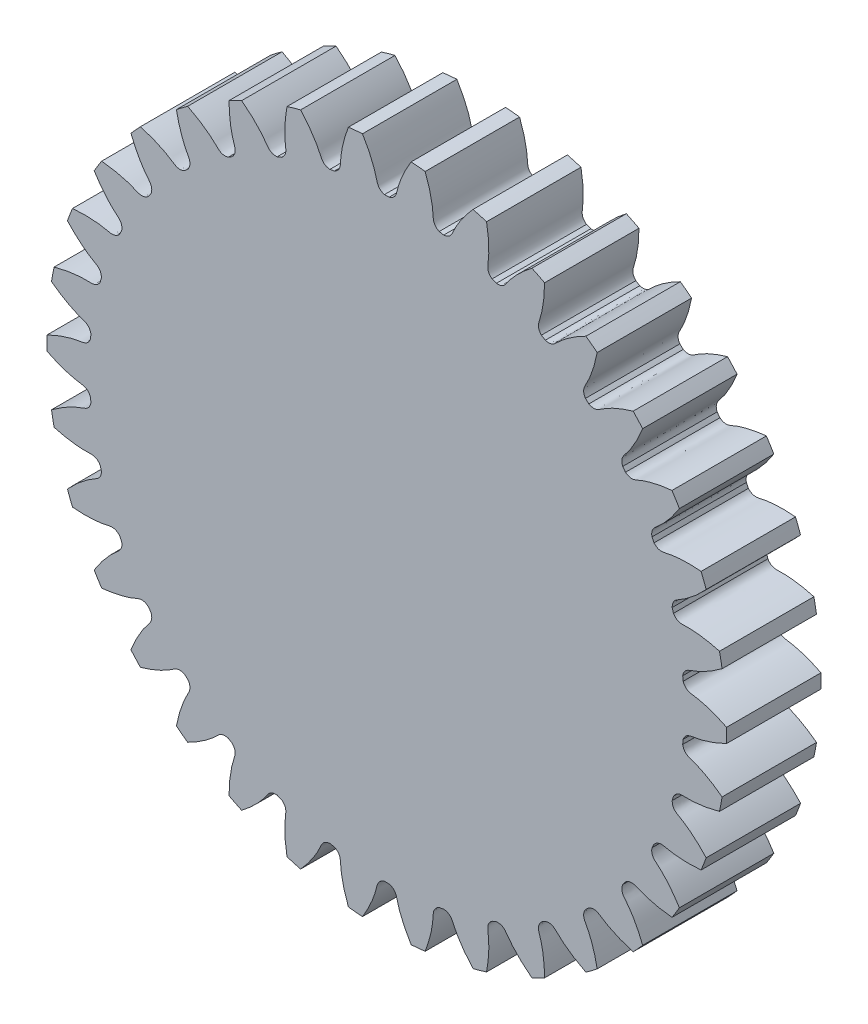
from build123d import *

# Parameters (mm, degrees)
SKETCH_1_R               = 36
EXTRUDE_1_DEPTH          = 10
CUT_EXTRUDE_1_DEPTH      = 52.884487084
PATTERN_CIRCULAR_1_COUNT = 34


with BuildPart() as part:
    # 草图1 → 凸台-拉伸1 (new body)
    with BuildSketch(Plane.XY):
        Circle(SKETCH_1_R)
    extrude(amount=EXTRUDE_1_DEPTH)

    # 草图2 → 切除-拉伸1 (cut, through all)
    with BuildSketch(Plane.XY):
        with BuildLine():
            ThreePointArc((0.244228233, 31.499053201), (0, 31.5), (-0.244228233, 31.499053201))
            add(Edge.make_bspline(
                [(-0.244228233, 31.499053201), (-0.955450407, 31.700150528), (-1.017880526, 32.25171642), (-1.173261808, 32.831506528), (-1.217240478, 32.984327762), (-1.268112325, 33.14841911), (-1.326257721, 33.32359997), (-1.392164873, 33.509628551), (-1.466281502, 33.706263121), (-1.549058656, 33.913243924), (-1.640937234, 34.130298768), (-1.742351485, 34.357141613), (-1.853727509, 34.593473236), (-1.975483234, 34.838981295), (-2.108027967, 35.09334058), (-2.251762073, 35.356213226), (-2.407076628, 35.627248943), (-2.574353084, 35.906085252), (-2.753962938, 36.192347737), (-2.946267409, 36.485650295), (-3.15161712, 36.785595401), (-3.370351788, 37.091774378), (-3.602799917, 37.403767677), (-3.849278502, 37.721145165), (-4.110092737, 38.043466416), (-4.385535732, 38.370281015), (-4.675888239, 38.701128865), (-4.981418373, 39.035540504), (-5.302381387, 39.373037427), (-5.63901929, 39.713132419), (-6.11518882, 40.175330095), (-6.487455745, 40.515334414), (-6.743151127, 40.739888723)],
                knots=[0, 0, 0, 0, 0.13072362, 0.143503881, 0.157401081, 0.17241522, 0.188546299, 0.205794316, 0.224159273, 0.243641169, 0.264240005, 0.285955779, 0.308788493, 0.332738146, 0.357804738, 0.383988269, 0.411288739, 0.439706149, 0.469240498, 0.499891786, 0.531660014, 0.56454518, 0.598547286, 0.633666331, 0.669902315, 0.707255238, 0.745725101, 0.785311903, 0.826015644, 0.867836324, 0.910773943, 1, 1, 1, 1], degree=3))
            ThreePointArc((-6.743151127, 40.739888723), (0, 41.294171747), (6.743151127, 40.739888723))
            add(Edge.make_bspline(
                [(0.244228233, 31.499053201), (0.955450407, 31.700150528), (1.017880526, 32.25171642), (1.173261808, 32.831506528), (1.217240478, 32.984327762), (1.268112325, 33.14841911), (1.326257721, 33.32359997), (1.392164873, 33.509628551), (1.466281502, 33.706263121), (1.549058656, 33.913243924), (1.640937234, 34.130298768), (1.742351485, 34.357141613), (1.853727509, 34.593473236), (1.975483234, 34.838981295), (2.108027967, 35.09334058), (2.251762073, 35.356213226), (2.407076628, 35.627248943), (2.574353084, 35.906085252), (2.753962938, 36.192347737), (2.946267409, 36.485650295), (3.15161712, 36.785595401), (3.370351788, 37.091774378), (3.602799917, 37.403767677), (3.849278502, 37.721145165), (4.110092737, 38.043466416), (4.385535732, 38.370281015), (4.675888239, 38.701128865), (4.981418373, 39.035540504), (5.302381387, 39.373037427), (5.63901929, 39.713132419), (6.11518882, 40.175330095), (6.487455745, 40.515334414), (6.743151127, 40.739888723)],
                knots=[0, 0, 0, 0, 0.13072362, 0.143503881, 0.157401081, 0.17241522, 0.188546299, 0.205794316, 0.224159273, 0.243641169, 0.264240005, 0.285955779, 0.308788493, 0.332738146, 0.357804738, 0.383988269, 0.411288739, 0.439706149, 0.469240498, 0.499891786, 0.531660014, 0.56454518, 0.598547286, 0.633666331, 0.669902315, 0.707255238, 0.745725101, 0.785311903, 0.826015644, 0.867836324, 0.910773943, 1, 1, 1, 1], degree=3))
        make_face()
    cut_extrude_1 = extrude(amount=CUT_EXTRUDE_1_DEPTH, mode=Mode.SUBTRACT)

    # 阵列(圆周)1: 切除-拉伸1 ×34 about axis
    pattern_circular_1_axis = Axis((0, 0, -0.5), (0, 0, 1))
    for i in range(1, PATTERN_CIRCULAR_1_COUNT):
        add(cut_extrude_1.rotate(pattern_circular_1_axis, i * 360 / PATTERN_CIRCULAR_1_COUNT), mode=Mode.SUBTRACT)


solid = part.part
